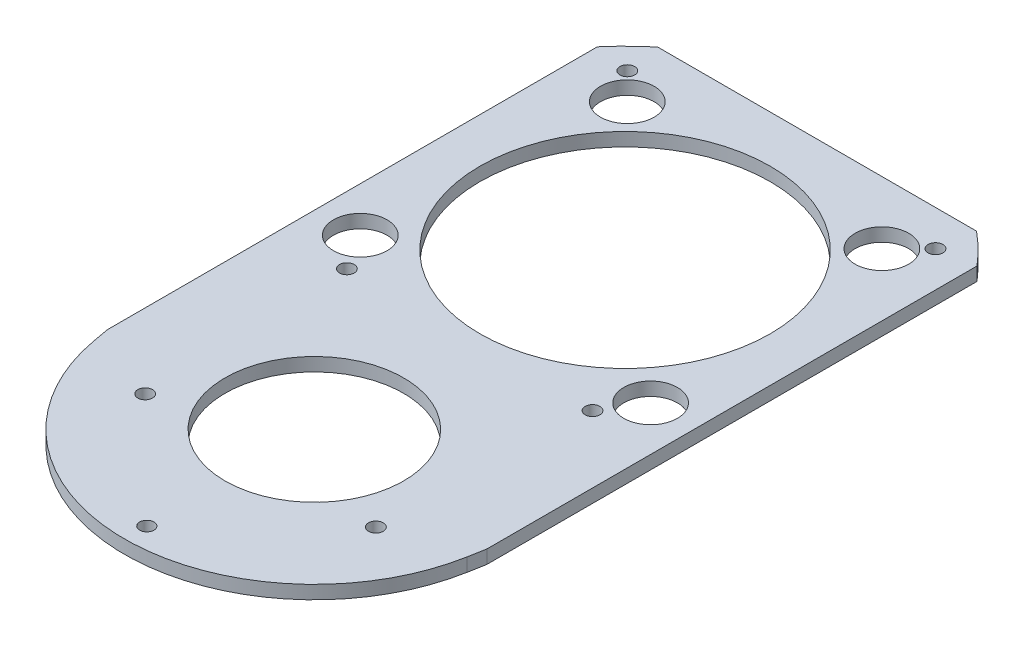
from build123d import *

# Parameters (mm, degrees)
SKETCH1_R           = 32.5
SKETCH1_R_2         = 20
BOSS_EXTRUDE1_DEPTH = 3
SKETCH5_R           = 1.6
CUT_EXTRUDE1_DEPTH  = 10
SKETCH6_R           = 1.65
CUT_EXTRUDE2_DEPTH  = 10
SKETCH8_R           = 6
CUT_EXTRUDE3_DEPTH  = 10


with BuildPart() as part:
    # Sketch1 → Boss-Extrude1 (new body)
    with BuildSketch(Plane(origin=(0, 0, 0), x_dir=(1, 0, 0), z_dir=(0, 1, 0))):
        with BuildLine():
            Line((-42.5, -73.411966665), (-41.810700901, -77.192472856))
            ThreePointArc((-41.810700901, -77.192472856), (0, -112.069134335), (41.810700901, -77.192472856))
            Line((41.810700901, -77.192472856), (42.5, -73.411966665))
            Line((42.5, -73.411966665), (42.5, 36.289181897))
            ThreePointArc((42.5, 36.289181897), (39.241370505, 39.790319974), (35.695303931, 43))
            Line((35.695303931, 43), (-35.695303931, 43))
            ThreePointArc((-35.695303931, 43), (-39.241370505, 39.790319974), (-42.5, 36.289181897))
            Line((-42.5, 36.289181897), (-42.5, -73.411966665))
        make_face()
        with Locations(Location((0, 0, 0), (0, 0, 270))):
            Circle(SKETCH1_R, mode=Mode.SUBTRACT)
        with Locations(Location((0, -69.569134335, 0), (0, 0, 270))):
            Circle(SKETCH1_R_2, mode=Mode.SUBTRACT)
    extrude(amount=BOSS_EXTRUDE1_DEPTH)

    # Sketch5 → Cut-Extrude1 (cut)
    with BuildSketch(Plane(origin=(0, 3, 0), x_dir=(1, 0, 0), z_dir=(0, 1, 0))):
        with Locations(Location((0, -107.069134335, 0), (0, 0, 270))):
            Circle(SKETCH5_R)
    extrude(amount=-CUT_EXTRUDE1_DEPTH, mode=Mode.SUBTRACT)

    # Sketch6 → Cut-Extrude2 (cut)
    with BuildSketch(Plane(origin=(0, 3, 0), x_dir=(1, 0, 0), z_dir=(0, 1, 0))):
        with Locations(Location((-34.5, 35, 0), (0, 0, 270))):
            Circle(SKETCH6_R)
        with Locations(Location((34.5, 35, 0), (0, 0, 270))):
            Circle(SKETCH6_R)
        with Locations(Location((27.5, -34.784567168, 0), (0, 0, 270))):
            Circle(SKETCH6_R)
        with Locations(Location((25.829771931, -81.613754795, 0), (0, 0, 270))):
            Circle(SKETCH6_R)
        with Locations(Location((-25.829771931, -81.613754795, 0), (0, 0, 270))):
            Circle(SKETCH6_R)
        with Locations(Location((-27.5, -34.784567168, 0), (0, 0, 270))):
            Circle(SKETCH6_R)
    extrude(amount=-CUT_EXTRUDE2_DEPTH, mode=Mode.SUBTRACT)

    # Sketch8 → Cut-Extrude3 (cut)
    with BuildSketch(Plane.XZ):
        with Locations(Location((28.5, -29, 0), (0, 0, 270))):
            Circle(SKETCH8_R)
        with Locations(Location((32.5, 26.784567168, 0), (0, 0, 270))):
            Circle(SKETCH8_R)
        with Locations(Location((-32.5, 26.784567168, 0), (0, 0, 90))):
            Circle(SKETCH8_R)
        with Locations(Location((-28.5, -29, 0), (0, 0, 90))):
            Circle(SKETCH8_R)
    extrude(amount=-CUT_EXTRUDE3_DEPTH, mode=Mode.SUBTRACT)


solid = part.part
